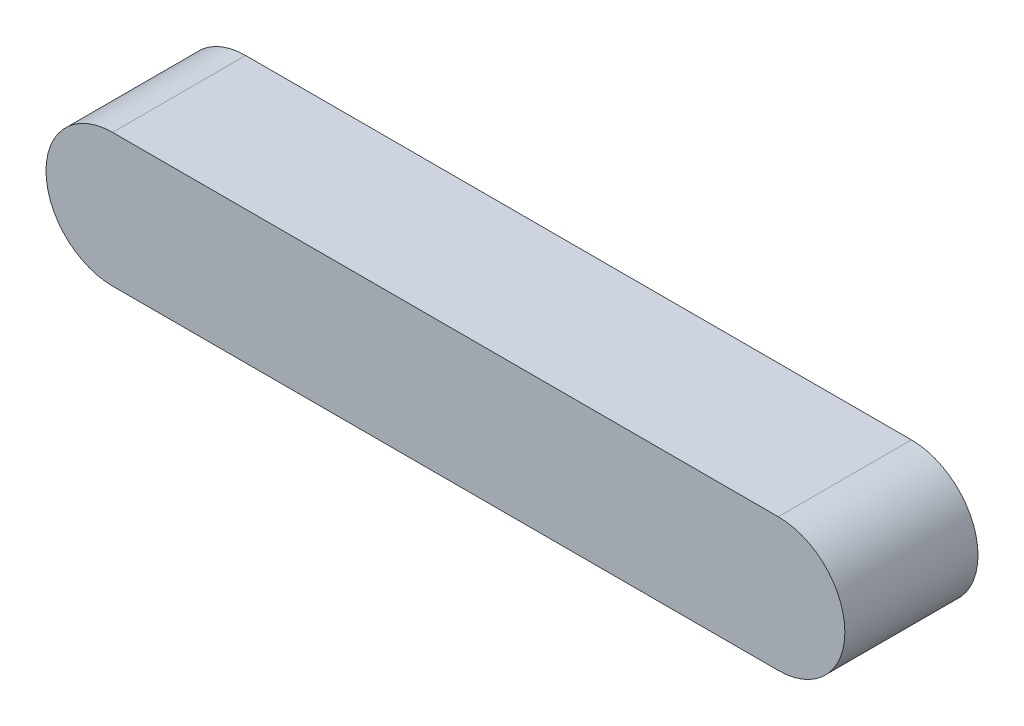
from build123d import *

# Parameters (mm, degrees)
BOSS_EXTRUDE1_DEPTH = 12.7


with BuildPart() as part:
    # Sketch1 → Boss-Extrude1 (new body)
    with BuildSketch(Plane.XY):
        with BuildLine():
            Line((0, 6.35), (63.5, 6.35))
            ThreePointArc((63.5, 6.35), (69.85, 0), (63.5, -6.35))
            Line((63.5, -6.35), (0, -6.35))
            ThreePointArc((0, -6.35), (-6.35, 0), (0, 6.35))
        make_face()
    extrude(amount=BOSS_EXTRUDE1_DEPTH)


solid = part.part
